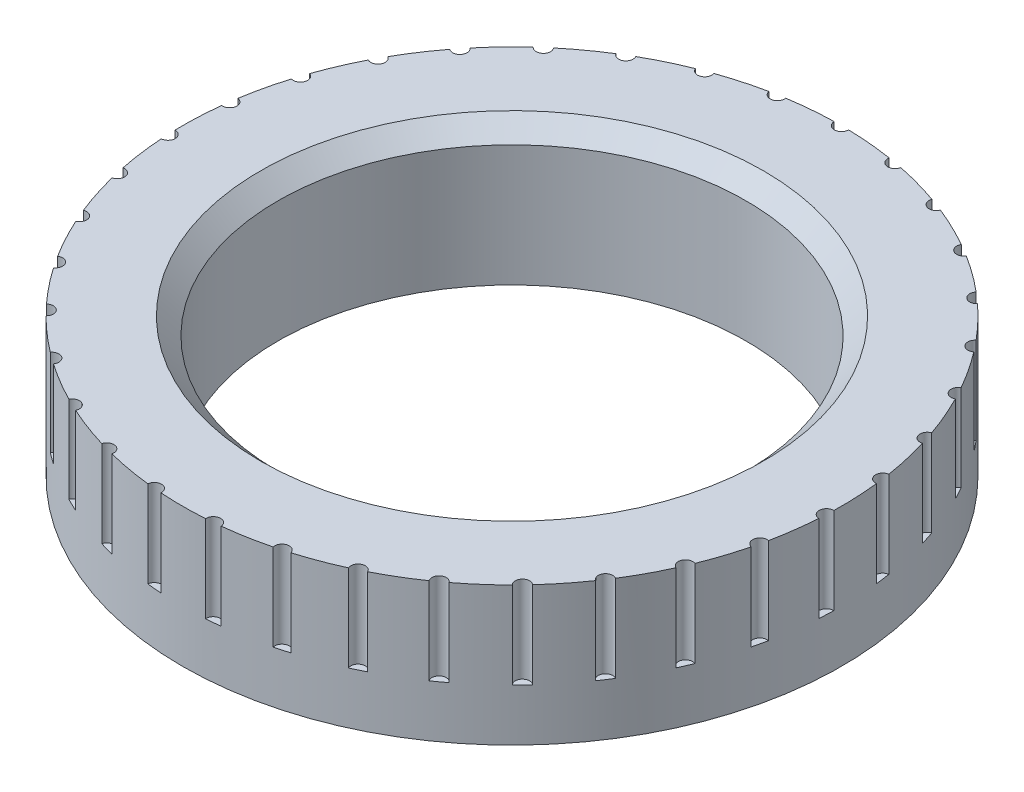
from build123d import *

# Parameters (mm, degrees)
SKETCH_1_R          = 19
SKETCH_1_R_2        = 13.5
EXTRUDE_1_DEPTH     = 8
SKETCH_2_R          = 0.415258627
CUT_EXTRUDE_2_DEPTH = 5
CHAMFER_1_SIZE      = 1


with BuildPart() as part:
    # 草图1 → 拉伸1 (new body)
    with BuildSketch(Plane(origin=(0, 0, 0), x_dir=(1, 0, 0), z_dir=(0, 1, 0))):
        with Locations(Location((0, 0, 0), (0, 0, 270))):
            Circle(SKETCH_1_R)
        with Locations(Location((0, 0, 0), (0, 0, 270))):
            Circle(SKETCH_1_R_2, mode=Mode.SUBTRACT)
    extrude(amount=EXTRUDE_1_DEPTH)

    # 草图2 → 拉伸2 (cut)
    with BuildSketch(Plane(origin=(0, 8, 0), x_dir=(1, 0, 0), z_dir=(0, 1, 0))):
        with Locations((0, 19)):
            Circle(SKETCH_2_R)
        with Locations((3.392581001, 18.694662183)):
            Circle(SKETCH_2_R)
        with Locations((6.676121658, 17.788462542)):
            Circle(SKETCH_2_R)
        with Locations((9.745086271, 16.310527078)):
            Circle(SKETCH_2_R)
        with Locations((12.500835793, 14.308357854)):
            Circle(SKETCH_2_R)
        with Locations((14.854798167, 11.846306235)):
            Circle(SKETCH_2_R)
        with Locations((16.731315105, 9.003504587)):
            Circle(SKETCH_2_R)
        with Locations((18.07007381, 5.871322893)):
            Circle(SKETCH_2_R)
        with Locations((18.828045474, 2.550432051)):
            Circle(SKETCH_2_R)
        with Locations((18.980868264, -0.852431777)):
            Circle(SKETCH_2_R)
        with Locations((18.523630331, -4.227897745)):
            Circle(SKETCH_2_R)
        with Locations((17.471027678, -7.467475601)):
            Circle(SKETCH_2_R)
        with Locations((15.856891821, -10.467042648)):
            Circle(SKETCH_2_R)
        with Locations((13.733102413, -13.130190331)):
            Circle(SKETCH_2_R)
        with Locations((11.167919794, -15.371322893)):
            Circle(SKETCH_2_R)
        with Locations((8.243791043, -17.11840849)):
            Circle(SKETCH_2_R)
        with Locations((5.054700066, -18.315294353)):
            Circle(SKETCH_2_R)
        with Locations((1.703146869, -18.923511586)):
            Circle(SKETCH_2_R)
        with Locations((-1.703146869, -18.923511586)):
            Circle(SKETCH_2_R)
        with Locations((-5.054700066, -18.315294353)):
            Circle(SKETCH_2_R)
        with Locations((-8.243791043, -17.11840849)):
            Circle(SKETCH_2_R)
        with Locations((-11.167919794, -15.371322893)):
            Circle(SKETCH_2_R)
        with Locations((-13.733102413, -13.130190331)):
            Circle(SKETCH_2_R)
        with Locations((-15.856891821, -10.467042648)):
            Circle(SKETCH_2_R)
        with Locations((-17.471027678, -7.467475601)):
            Circle(SKETCH_2_R)
        with Locations((-18.523630331, -4.227897745)):
            Circle(SKETCH_2_R)
        with Locations((-18.980868264, -0.852431777)):
            Circle(SKETCH_2_R)
        with Locations((-18.828045474, 2.550432051)):
            Circle(SKETCH_2_R)
        with Locations((-18.07007381, 5.871322893)):
            Circle(SKETCH_2_R)
        with Locations((-16.731315105, 9.003504587)):
            Circle(SKETCH_2_R)
        with Locations((-14.854798167, 11.846306235)):
            Circle(SKETCH_2_R)
        with Locations((-12.500835793, 14.308357854)):
            Circle(SKETCH_2_R)
        with Locations((-9.745086271, 16.310527078)):
            Circle(SKETCH_2_R)
        with Locations((-6.676121658, 17.788462542)):
            Circle(SKETCH_2_R)
        with Locations((-3.392581001, 18.694662183)):
            Circle(SKETCH_2_R)
    extrude(amount=-CUT_EXTRUDE_2_DEPTH, mode=Mode.SUBTRACT)

    # 倒角1
    chamfer_1_edges = [part.edges().sort_by_distance(p)[0] for p in [
        (0, 8, -13.5),
    ]]
    chamfer(chamfer_1_edges, length=CHAMFER_1_SIZE)


solid = part.part
